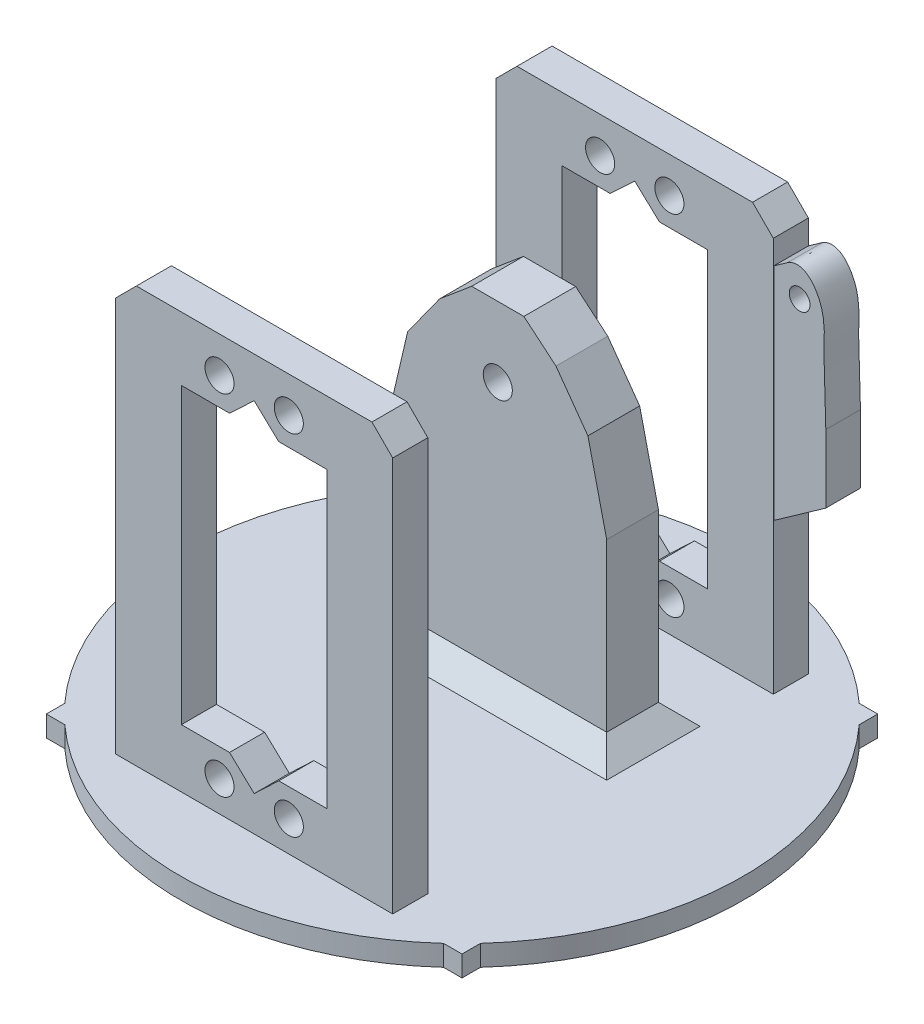
from build123d import *

# Parameters (mm, degrees)
ESQUISSE1_W                  = 60
ESQUISSE1_H                  = 60
BOSS_EXTRU_1_DEPTH           = 3
ESQUISSE2_W                  = 40
ESQUISSE2_H                  = 5.064093089
BOSS_EXTRU_2_DEPTH           = 60
ESQUISSE3_R                  = 2.1
ESQUISSE3_W                  = 21
ESQUISSE3_H                  = 42.4
ENL_V_MAT_EXTRU_1_DEPTH      = 61
ESQUISSE4_W                  = 31.43634342
ESQUISSE4_H                  = 7.471813822
BOSS_EXTRU_3_DEPTH           = 49
ENL_V_MAT_EXTRU_2_DEPTH      = 49
ENL_V_MAT_EXTRU_2_DEPTH_BACK = 49
ESQUISSE5_R                  = 2.1
ENL_V_MAT_EXTRU_3_DEPTH      = 5
ENL_V_MAT_EXTRU_3_DEPTH_BACK = 12
ENL_V_MAT_EXTRU_7_DEPTH      = 5.686588472
BOSS_EXTRU_4_DEPTH           = 5
ESQUISSE13_R                 = 1.5
ENL_V_MAT_EXTRU_8_DEPTH      = 5
ENL_V_MAT_EXTRU_9_DEPTH      = 10
CHANFREIN1_SIZE              = 3
CHANFREIN2_SIZE              = 3
ESQUISSE15_R                 = 40.585379392
BOSS_EXTRU_5_DEPTH           = 3
ESQUISSE16_R                 = 4
BOSS_EXTRU_6_DEPTH           = 5.5
ESQUISSE17_R                 = 34
ESQUISSE17_R_2               = 31
BOSS_EXTRU_7_DEPTH           = 1.5


with BuildPart() as part:
    # Esquisse1 → Boss.-Extru.1 (new body)
    with BuildSketch(Plane(origin=(0, 0, 0), x_dir=(1, 0, 0), z_dir=(0, 1, 0))):
        Rectangle(ESQUISSE1_W, ESQUISSE1_H)
    extrude(amount=BOSS_EXTRU_1_DEPTH)

    # Esquisse2 → Boss.-Extru.2 (add)
    with BuildSketch(Plane(origin=(0, 3, 0), x_dir=(1, 0, 0), z_dir=(0, 1, 0))):
        with Locations((0, -27.467953456)):
            Rectangle(ESQUISSE2_W, ESQUISSE2_H)
        with Locations((0, 27.467953456)):
            Rectangle(ESQUISSE2_W, ESQUISSE2_H)
    extrude(amount=BOSS_EXTRU_2_DEPTH)

    # Esquisse3 → Enlèv. mat.-Extru.1 (cut)
    with BuildSketch(Plane.XY.offset(30)):
        with Locations((-5, 57.819250322)):
            Circle(ESQUISSE3_R)
        with Locations((5, 57.819250322)):
            Circle(ESQUISSE3_R)
        with Locations((-5, 7.419250322)):
            Circle(ESQUISSE3_R)
        with Locations((5, 7.419250322)):
            Circle(ESQUISSE3_R)
        with Locations((0, 32.619250322)):
            Rectangle(ESQUISSE3_W, ESQUISSE3_H)
    extrude(amount=-ENL_V_MAT_EXTRU_1_DEPTH, mode=Mode.SUBTRACT)

    # Esquisse4 → Boss.-Extru.3 (add)
    with BuildSketch(Plane(origin=(0, 3, 0), x_dir=(1, 0, 0), z_dir=(0, 1, 0))):
        with Locations((0, 8.9)):
            Rectangle(ESQUISSE4_W, ESQUISSE4_H)
    extrude(amount=BOSS_EXTRU_3_DEPTH)

    # Esquisse5 → Enlèv. mat.-Extru.2 (cut, two sides: drawn at the far end of the back side and taken through both)
    with BuildSketch(Plane.XY.offset(-5.164093089).offset(-ENL_V_MAT_EXTRU_2_DEPTH_BACK)):
        with Locations(Location((0, 41.884866589, 0), (0, 0, 180))):
            Circle(ESQUISSE5_R)
    extrude(amount=ENL_V_MAT_EXTRU_2_DEPTH + ENL_V_MAT_EXTRU_2_DEPTH_BACK, mode=Mode.SUBTRACT)

    # Esquisse6 → Enlèv. mat.-Extru.3 (cut, two sides: drawn at the far end of the back side and taken through both)
    with BuildSketch(Plane.XY.offset(-5.164093089).offset(-ENL_V_MAT_EXTRU_3_DEPTH_BACK)):
        Polygon((3.765814794, 52), (-3.765814794, 52), (-8.396406616, 48.113602092), (-13.009515703, 41.697186725), (-16.070942643, 28.570794505), (-19.383993714, 28.570794505), (-19.383993714, 55.569676943), (19.383993714, 55.569676943), (19.383993714, 28.570794505), (16.070942643, 28.570794505), (13.009515703, 41.697186725), (8.396406616, 48.113602092), align=None)
    extrude(amount=ENL_V_MAT_EXTRU_3_DEPTH + ENL_V_MAT_EXTRU_3_DEPTH_BACK, mode=Mode.SUBTRACT)

    # Esquisse11 → Enlèv. mat.-Extru.7 (cut)
    with BuildSketch(Plane.XY.offset(30)):
        Polygon((-3.554651837, 53.819250322), (0, 57.156758738), (3.554651837, 53.819250322), align=None)
        Polygon((3.554651837, 11.419250322), (0.008232601, 8.05699671), (-3.554651837, 11.419250322), align=None)
    enl_v_mat_extru_7 = extrude(amount=-ENL_V_MAT_EXTRU_7_DEPTH, mode=Mode.SUBTRACT)

    # Symétrie1: Enlèv. mat.-Extru.7 across plane
    add(enl_v_mat_extru_7.mirror(Plane.XY), mode=Mode.SUBTRACT)

    # Esquisse12 → Boss.-Extru.4 (add)
    with BuildSketch(Plane(origin=(0, 0, -30), x_dir=(-1, 0, 0), z_dir=(0, 0, -1))):
        Polygon((-16.041577075, 53.722563772), (-27.510987985, 61.809968901), (-27.510987985, 29.990434482), (-16.041577075, 21.903029354), align=None)
    extrude(amount=-BOSS_EXTRU_4_DEPTH)

    # Esquisse13 → Enlèv. mat.-Extru.8 (cut)
    with BuildSketch(Plane(origin=(0, 0, -30), x_dir=(-1, 0, 0), z_dir=(0, 0, -1))):
        with Locations((-23.733778696, 54.232255727)):
            Circle(ESQUISSE13_R)
    extrude(amount=-ENL_V_MAT_EXTRU_8_DEPTH, mode=Mode.SUBTRACT)

    # Esquisse14 → Enlèv. mat.-Extru.9 (cut)
    with BuildSketch(Plane(origin=(0, 0, -30), x_dir=(-1, 0, 0), z_dir=(0, 0, -1))):
        with BuildLine():
            Line((-21.71817898, 57.725295885), (-22.313097289, 61.571545457))
            Line((-22.313097289, 61.571545457), (-29.123823422, 63.566297114))
            Line((-29.123823422, 63.566297114), (-31.434035617, 54.282245365))
            Line((-31.434035617, 54.282245365), (-31.802093045, 39.80867485))
            Line((-31.802093045, 39.80867485), (-27.510987985, 39.80867485))
            add(Edge.make_bspline(
                [(-27.510987985, 39.80867485), (-27.476511879, 42.426218442), (-27.330002572, 45.177230576), (-27.18875986, 50.317216066), (-27.834123365, 55.293883989), (-23.939343069, 59.432145797), (-21.71817898, 57.725295885)],
                knots=[0, 0, 0, 0, 0.330124206, 0.401515798, 0.713915923, 1, 1, 1, 1], degree=3))
        make_face()
    extrude(amount=-ENL_V_MAT_EXTRU_9_DEPTH, mode=Mode.SUBTRACT)

    # Chanfrein1
    chanfrein1_edges = [part.edges().sort_by_distance(p)[0] for p in [
        (-20, 63, 27.467953456),
        (20, 63, 27.467953456),
        (20, 63, -27.467953456),
        (-20, 63, -27.467953456),
    ]]
    chamfer(chanfrein1_edges, length=CHANFREIN1_SIZE)

    # Chanfrein2
    chanfrein2_edges = [part.edges().sort_by_distance(p)[0] for p in [
        (15.71817171, 3, -8.9),
        (0, 3, -12.635906911),
        (-15.71817171, 3, -8.9),
        (0, 3, -5.164093089),
    ]]
    chamfer(chanfrein2_edges, length=CHANFREIN2_SIZE)

    # Esquisse15 → Boss.-Extru.5 (add)
    with BuildSketch(Plane.XZ):
        Circle(ESQUISSE15_R)
    extrude(amount=-BOSS_EXTRU_5_DEPTH)

    # Esquisse16 → Boss.-Extru.6 (add)
    with BuildSketch(Plane.XZ):
        with Locations(Location((0, 0, 0), (0, 0, 90))):
            Circle(ESQUISSE16_R)
        with BuildLine():
            Line((1.5, -2), (-1.5, -2))
            add(Edge.make_bspline(
                [(-1.5, 2), (-1.958697555, 1.657983746), (-2.533324792, 0.788068376), (-2.517224478, -0.822180507), (-1.942930835, -1.670082257), (-1.5, -2)],
                knots=[0, 0, 0, 0, 0.368917338, 0.642208585, 1, 1, 1, 1], degree=3))
            Line((-1.5, 2), (1.5, 2))
            add(Edge.make_bspline(
                [(1.5, 2), (1.95810566, 1.657096874), (2.561237256, 0.750226685), (2.498088101, -0.878428585), (1.905080516, -1.696028501), (1.5, -2)],
                knots=[0, 0, 0, 0, 0.369168068, 0.672222531, 1, 1, 1, 1], degree=3))
        make_face(mode=Mode.SUBTRACT)
    extrude(amount=BOSS_EXTRU_6_DEPTH)

    # Esquisse17 → Boss.-Extru.7 (add)
    with BuildSketch(Plane.XZ):
        with Locations(Location((0, 0, 0), (0, 0, 90))):
            Circle(ESQUISSE17_R)
        with Locations(Location((0, 0, 0), (0, 0, 270))):
            Circle(ESQUISSE17_R_2, mode=Mode.SUBTRACT)
    extrude(amount=BOSS_EXTRU_7_DEPTH)


solid = part.part
